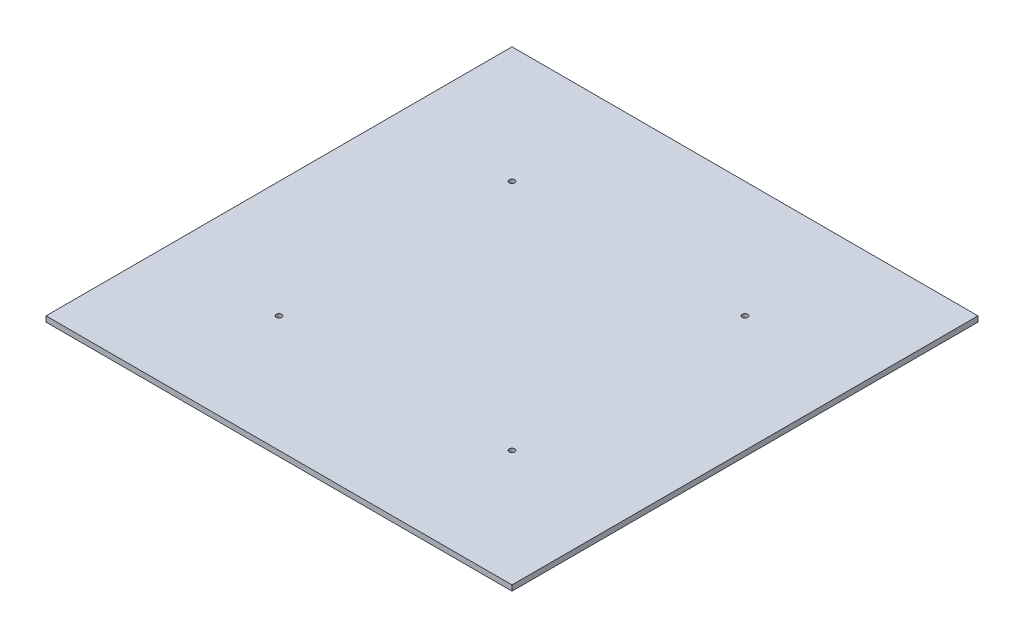
from build123d import *

# Parameters (mm, degrees)
SKETCH1_W           = 256
SKETCH1_H           = 256
SKETCH1_R           = 1.5
BOSS_EXTRUDE1_DEPTH = 1.5


with BuildPart() as part:
    # Sketch1 → Boss-Extrude1 (new, symmetric)
    with BuildSketch(Plane(origin=(0, 0, 0), x_dir=(1, 0, 0), z_dir=(0, 1, 0))):
        Rectangle(SKETCH1_W, SKETCH1_H)
        with Locations(Location((-64, 64, 0), (0, 0, 270))):
            Circle(SKETCH1_R, mode=Mode.SUBTRACT)
        with Locations(Location((64, 64, 0), (0, 0, 270))):
            Circle(SKETCH1_R, mode=Mode.SUBTRACT)
        with Locations(Location((64, -64, 0), (0, 0, 270))):
            Circle(SKETCH1_R, mode=Mode.SUBTRACT)
        with Locations(Location((-64, -64, 0), (0, 0, 270))):
            Circle(SKETCH1_R, mode=Mode.SUBTRACT)
    extrude(amount=BOSS_EXTRUDE1_DEPTH, both=True)


solid = part.part
